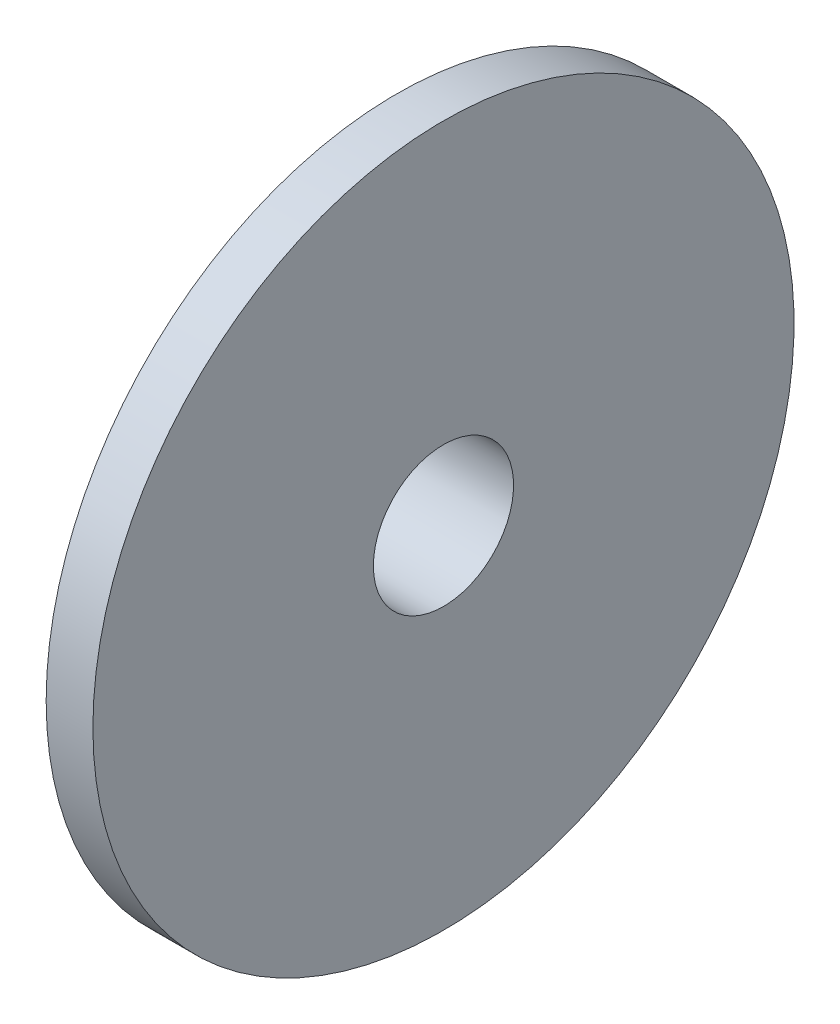
from build123d import *

# Parameters (mm, degrees)
CHAMFER_1_SIZE = 0.2


with BuildPart() as part:
    # 草图1 → 旋转1 (revolve)
    with BuildSketch(Plane.XY, mode=Mode.PRIVATE) as revolve_1_sk:
        Polygon((0, 1.5), (0, 7.5), (-1, 7.5), (-1, 2.75), (-3.5, 2.75), (-3.5, 1.5), align=None)
    revolve(revolve_1_sk.sketch.rotate(Axis((-9.1, 0, 0), (1, 0, 0)), 90), axis=Axis((-9.1, 0, 0), (1, 0, 0)))

    # 倒角1
    chamfer_1_edges = [part.edges().sort_by_distance(p)[0] for p in [
        (-3.5, 0, -1.5),
        (-3.5, 0, -2.75),
    ]]
    chamfer(chamfer_1_edges, length=CHAMFER_1_SIZE)


solid = part.part
